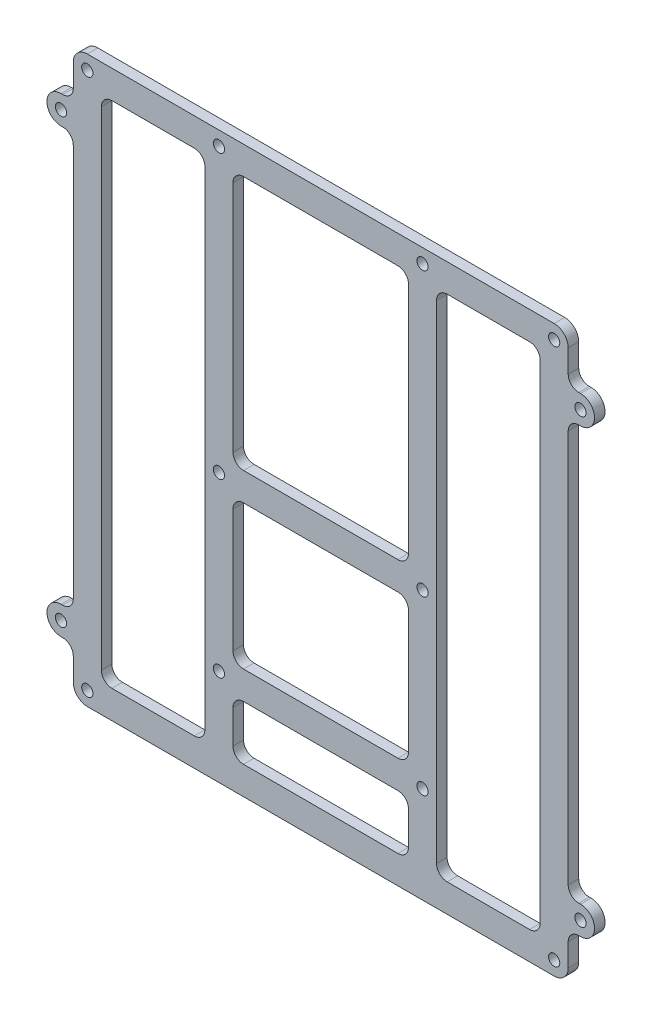
from build123d import *

# Parameters (mm, degrees)
MODEL_R             = 1.6
BOSS_EXTRUDE1_DEPTH = 3


with BuildPart() as part:
    # Model → Boss-Extrude1 (new body)
    with BuildSketch(Plane.XY):
        with BuildLine():
            Line((-70.5, 76.5), (-70.5, 70))
            ThreePointArc((-70.5, 70), (-71.378679656, 67.878679656), (-73.5, 67))
            Line((-73.5, 67), (-74, 67))
            ThreePointArc((-74, 67), (-78, 63), (-74, 59))
            Line((-74, 59), (-73.5, 59))
            ThreePointArc((-73.5, 59), (-71.378679656, 58.121320344), (-70.5, 56))
            Line((-70.5, 56), (-70.5, -56))
            ThreePointArc((-70.5, -56), (-71.378679656, -58.121320344), (-73.5, -59))
            Line((-73.5, -59), (-74, -59))
            ThreePointArc((-74, -59), (-78, -63), (-74, -67))
            Line((-74, -67), (-73.5, -67))
            ThreePointArc((-73.5, -67), (-71.378679656, -67.878679656), (-70.5, -70))
            Line((-70.5, -70), (-70.5, -76.5))
            ThreePointArc((-70.5, -76.5), (-69.328427125, -79.328427125), (-66.5, -80.5))
            Line((-66.5, -80.5), (66.5, -80.5))
            ThreePointArc((66.5, -80.5), (69.328427125, -79.328427125), (70.5, -76.5))
            Line((70.5, -76.5), (70.5, -70))
            ThreePointArc((70.5, -70), (71.378679656, -67.878679656), (73.5, -67))
            Line((73.5, -67), (74, -67))
            ThreePointArc((74, -67), (78, -63), (74, -59))
            Line((74, -59), (73.5, -59))
            ThreePointArc((73.5, -59), (71.378679656, -58.121320344), (70.5, -56))
            Line((70.5, -56), (70.5, 56))
            ThreePointArc((70.5, 56), (71.378679656, 58.121320344), (73.5, 59))
            Line((73.5, 59), (74, 59))
            ThreePointArc((74, 59), (78, 63), (74, 67))
            Line((74, 67), (73.5, 67))
            ThreePointArc((73.5, 67), (71.378679656, 67.878679656), (70.5, 70))
            Line((70.5, 70), (70.5, 76.5))
            ThreePointArc((70.5, 76.5), (69.328427125, 79.328427125), (66.5, 80.5))
            Line((66.5, 80.5), (-66.5, 80.5))
            ThreePointArc((-66.5, 80.5), (-69.328427125, 79.328427125), (-70.5, 76.5))
        make_face()
        with Locations((66.5, 76.5)):
            Circle(MODEL_R, mode=Mode.SUBTRACT)
        with Locations((66.5, -76.5)):
            Circle(MODEL_R, mode=Mode.SUBTRACT)
        with Locations((-66.5, 76.5)):
            Circle(MODEL_R, mode=Mode.SUBTRACT)
        with Locations((-66.5, -76.5)):
            Circle(MODEL_R, mode=Mode.SUBTRACT)
        with Locations((-74, 63)):
            Circle(MODEL_R, mode=Mode.SUBTRACT)
        with Locations((74, 63)):
            Circle(MODEL_R, mode=Mode.SUBTRACT)
        with Locations((-74, -63)):
            Circle(MODEL_R, mode=Mode.SUBTRACT)
        with Locations((74, -63)):
            Circle(MODEL_R, mode=Mode.SUBTRACT)
        with Locations((29, -53)):
            Circle(MODEL_R, mode=Mode.SUBTRACT)
        with Locations((29, -4)):
            Circle(MODEL_R, mode=Mode.SUBTRACT)
        with Locations((-29, -53)):
            Circle(MODEL_R, mode=Mode.SUBTRACT)
        with Locations((-29, -4)):
            Circle(MODEL_R, mode=Mode.SUBTRACT)
        with Locations((29, 76.5)):
            Circle(MODEL_R, mode=Mode.SUBTRACT)
        with Locations((-29, 76.5)):
            Circle(MODEL_R, mode=Mode.SUBTRACT)
        with BuildLine():
            Line((-62.5, 69.5), (-62.5, -69.5))
            ThreePointArc((-62.5, -69.5), (-61.621320344, -71.621320344), (-59.5, -72.5))
            Line((-59.5, -72.5), (-36, -72.5))
            ThreePointArc((-36, -72.5), (-33.878679656, -71.621320344), (-33, -69.5))
            Line((-33, -69.5), (-33, 69.5))
            ThreePointArc((-33, 69.5), (-33.878679656, 71.621320344), (-36, 72.5))
            Line((-36, 72.5), (-59.5, 72.5))
            ThreePointArc((-59.5, 72.5), (-61.621320344, 71.621320344), (-62.5, 69.5))
        make_face(mode=Mode.SUBTRACT)
        with BuildLine():
            Line((-22, -72.5), (22, -72.5))
            ThreePointArc((22, -72.5), (24.121320344, -71.621320344), (25, -69.5))
            Line((25, -69.5), (25, -60))
            ThreePointArc((25, -60), (24.121320344, -57.878679656), (22, -57))
            Line((22, -57), (-22, -57))
            ThreePointArc((-22, -57), (-24.121320344, -57.878679656), (-25, -60))
            Line((-25, -60), (-25, -69.5))
            ThreePointArc((-25, -69.5), (-24.121320344, -71.621320344), (-22, -72.5))
        make_face(mode=Mode.SUBTRACT)
        with BuildLine():
            Line((36, -72.5), (59.5, -72.5))
            ThreePointArc((59.5, -72.5), (61.621320344, -71.621320344), (62.5, -69.5))
            Line((62.5, -69.5), (62.5, 69.5))
            ThreePointArc((62.5, 69.5), (61.621320344, 71.621320344), (59.5, 72.5))
            Line((59.5, 72.5), (36, 72.5))
            ThreePointArc((36, 72.5), (33.878679656, 71.621320344), (33, 69.5))
            Line((33, 69.5), (33, -69.5))
            ThreePointArc((33, -69.5), (33.878679656, -71.621320344), (36, -72.5))
        make_face(mode=Mode.SUBTRACT)
        with BuildLine():
            Line((22, 72.5), (-22, 72.5))
            ThreePointArc((-22, 72.5), (-24.121320344, 71.621320344), (-25, 69.5))
            Line((-25, 69.5), (-25, 3))
            ThreePointArc((-25, 3), (-24.121320344, 0.878679656), (-22, 0))
            Line((-22, 0), (22, 0))
            ThreePointArc((22, 0), (24.121320344, 0.878679656), (25, 3))
            Line((25, 3), (25, 69.5))
            ThreePointArc((25, 69.5), (24.121320344, 71.621320344), (22, 72.5))
        make_face(mode=Mode.SUBTRACT)
        with BuildLine():
            Line((-25, -11), (-25, -46))
            ThreePointArc((-25, -46), (-24.121320344, -48.121320344), (-22, -49))
            Line((-22, -49), (22, -49))
            ThreePointArc((22, -49), (24.121320344, -48.121320344), (25, -46))
            Line((25, -46), (25, -11))
            ThreePointArc((25, -11), (24.121320344, -8.878679656), (22, -8))
            Line((22, -8), (-22, -8))
            ThreePointArc((-22, -8), (-24.121320344, -8.878679656), (-25, -11))
        make_face(mode=Mode.SUBTRACT)
    extrude(amount=BOSS_EXTRUDE1_DEPTH)


solid = part.part
